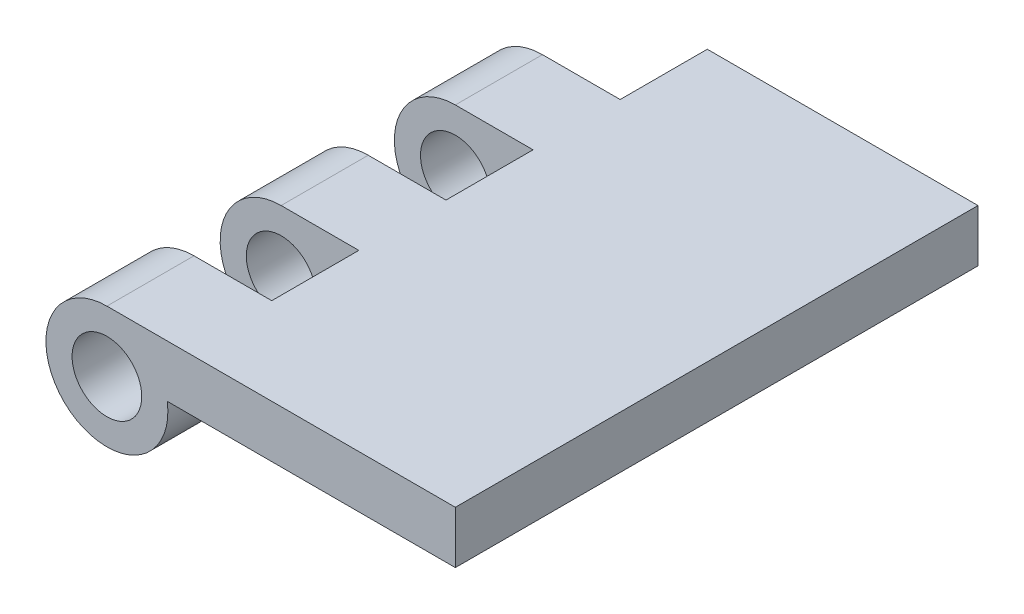
from build123d import *

# Parameters (mm, degrees)
SKETCH_1_R          = 2
EXTRUDE_1_DEPTH     = 15
SKETCH_3_W          = 11.247165533
SKETCH_3_H          = 5
SKETCH_3_W_2        = 13.020912068
SKETCH_3_H_2        = 7.860922147
CUT_EXTRUDE_1_DEPTH = 15


with BuildPart() as part:
    # 草图1 → 凸台-拉伸1 (new, symmetric)
    with BuildSketch(Plane.XY):
        with BuildLine():
            Line((0, -3.5), (20, -3.5))
            Line((20, -3.5), (20, -0.5))
            Line((20, -0.5), (3.464101615, -0.5))
            ThreePointArc((3.464101615, -0.5), (-2.291287847, 2.645751311), (0, -3.5))
        make_face()
        Circle(SKETCH_1_R, mode=Mode.SUBTRACT)
    extrude(amount=EXTRUDE_1_DEPTH, both=True)

    # 草图3 → 切除-拉伸1 (cut, symmetric)
    with BuildSketch(Plane(origin=(0, 0, 0), x_dir=(1, 0, 0), z_dir=(0, 1, 0))):
        with Locations((-1.162950365, 7.5)):
            Rectangle(SKETCH_3_W, SKETCH_3_H)
        with Locations((-1.162950365, -2.5)):
            Rectangle(SKETCH_3_W, SKETCH_3_H)
        with Locations((-2.049823633, -13.930461074)):
            Rectangle(SKETCH_3_W_2, SKETCH_3_H_2)
    extrude(amount=CUT_EXTRUDE_1_DEPTH, both=True, mode=Mode.SUBTRACT)


with BuildPart() as body_2:
    # 镜向1: mirrored copy
    add(part.part.mirror(Plane.XY.offset(-15)))


with BuildPart() as body_3:
    # 镜向2: mirrored copy
    add(body_2.part.mirror(Plane(origin=(0, -3.5, -45), x_dir=(0, 0, 1), z_dir=(0, 1, 0))))


solid = body_3.part
